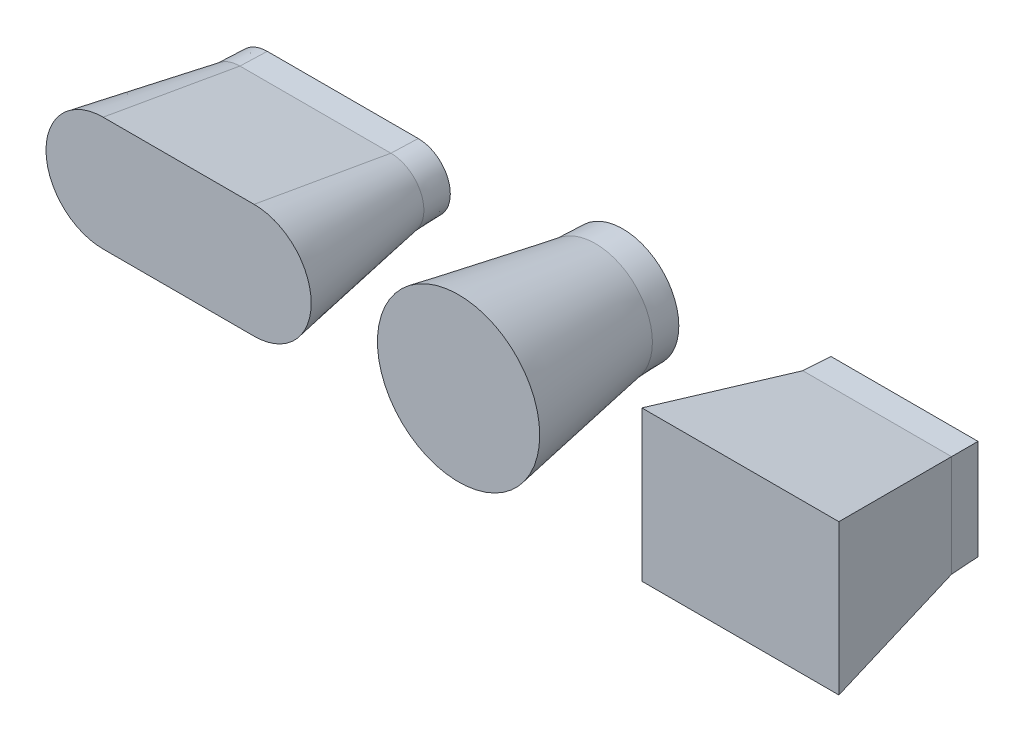
from build123d import *

# Parameters (mm, degrees)
SKETCH4_R                     = 20.836253608
SKETCH4_W                     = 54.370861329
SKETCH4_H                     = 37.229308989
BOSS_EXTRUDE1_DEPTH           = 50
BOSS_EXTRUDE1_TAPER           = -10
BOSS_EXTRUDE1_OTHER_WAY_DEPTH = 10
BOSS_EXTRUDE1_OTHER_WAY_TAPER = 2


with BuildPart() as part:
    # Sketch4 → Boss-Extrude1 (new body)
    with BuildSketch(Plane.XY):
        with Locations((-25.980165266, 12.990082633)):
            Circle(SKETCH4_R)
        with BuildLine():
            ThreePointArc((-155.880991595, 25.042736622), (-167.933645584, 12.990082633), (-155.880991595, 0.937428644))
            Line((-155.880991595, 0.937428644), (-100.706619999, 0.937428644))
            ThreePointArc((-100.706619999, 0.937428644), (-88.65396601, 12.990082633), (-100.706619999, 25.042736622))
            Line((-100.706619999, 25.042736622), (-155.880991595, 25.042736622))
        make_face()
        with Locations((77.003067153, 12.856164256)):
            Rectangle(SKETCH4_W, SKETCH4_H)
    extrude(amount=BOSS_EXTRUDE1_DEPTH, taper=BOSS_EXTRUDE1_TAPER)

    # Sketch4 → Boss-Extrude1 other way (add)
    with BuildSketch(Plane.XY):
        with Locations((-25.980165266, 12.990082633)):
            Circle(SKETCH4_R)
        with BuildLine():
            ThreePointArc((-155.880991595, 25.042736622), (-167.933645584, 12.990082633), (-155.880991595, 0.937428644))
            Line((-155.880991595, 0.937428644), (-100.706619999, 0.937428644))
            ThreePointArc((-100.706619999, 0.937428644), (-88.65396601, 12.990082633), (-100.706619999, 25.042736622))
            Line((-100.706619999, 25.042736622), (-155.880991595, 25.042736622))
        make_face()
        with Locations((77.003067153, 12.856164256)):
            Rectangle(SKETCH4_W, SKETCH4_H)
    extrude(amount=-BOSS_EXTRUDE1_OTHER_WAY_DEPTH, taper=BOSS_EXTRUDE1_OTHER_WAY_TAPER)


solid = part.part
